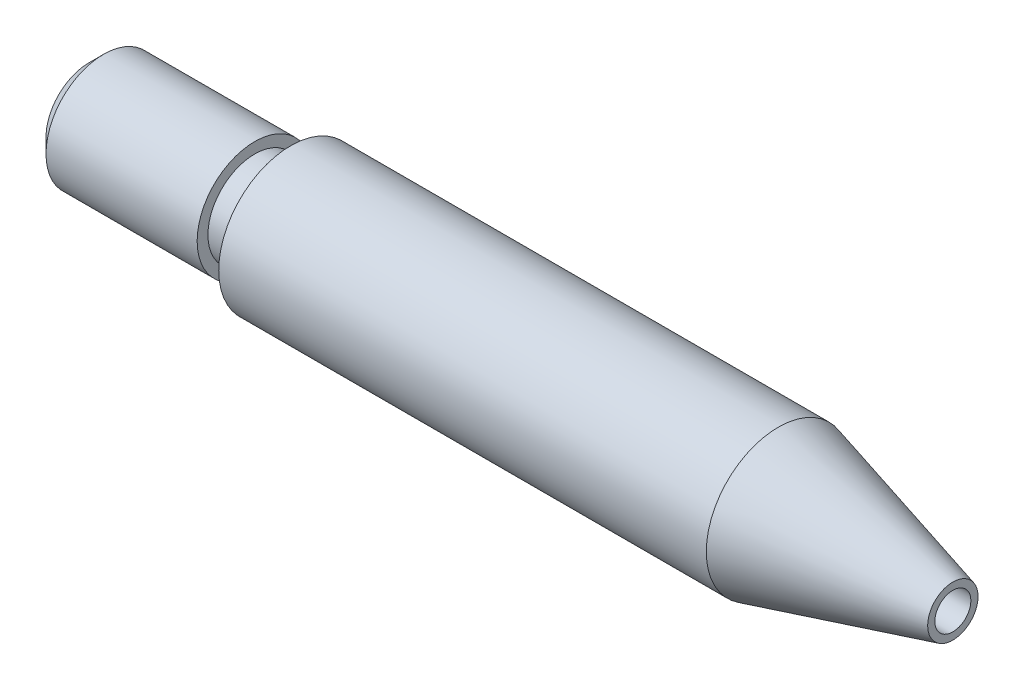
from build123d import *

# Parameters (mm, degrees)
SKETCH_2_R          = 1.75
CUT_EXTRUDE_2_DEPTH = 56
SKETCH_3_R          = 1.25
CUT_EXTRUDE_3_DEPTH = 61.415229868
CHAMFER_1_SIZE      = 1


with BuildPart() as part:
    # 草图1 → 旋转2 (revolve)
    with BuildSketch(Plane.XY, mode=Mode.PRIVATE) as revolve_2_sk:
        Polygon((-8.728334407, 0), (-49.046975166, 0), (-49.046975166, 4), (-37.546975166, 4), (-37.546975166, 3.25), (-35.046975166, 3.25), (-35.046975166, 5), (-1.17614029, 5), (10.953024834, 1.75), (10.953024834, 0), align=None)
    revolve(revolve_2_sk.sketch.rotate(Axis((-15.390186902, 0, 0), (1, 0, 0)), 90), axis=Axis((-15.390186902, 0, 0), (1, 0, 0)))

    # 草图2 → 切除-拉伸2 (cut)
    with BuildSketch(Plane.ZY.offset(49.046975166)):
        Circle(SKETCH_2_R)
    extrude(amount=-CUT_EXTRUDE_2_DEPTH, mode=Mode.SUBTRACT)

    # 草图3 → 切除-拉伸3 (cut, through all)
    with BuildSketch(Plane(origin=(10.953024834, 0, 0), x_dir=(0, 0, -1), z_dir=(1, 0, 0))):
        Circle(SKETCH_3_R)
    extrude(amount=-CUT_EXTRUDE_3_DEPTH, mode=Mode.SUBTRACT)

    # 倒角1
    chamfer_1_edges = [part.edges().sort_by_distance(p)[0] for p in [
        (-49.046975166, 0, -4),
    ]]
    chamfer(chamfer_1_edges, length=CHAMFER_1_SIZE)


solid = part.part
